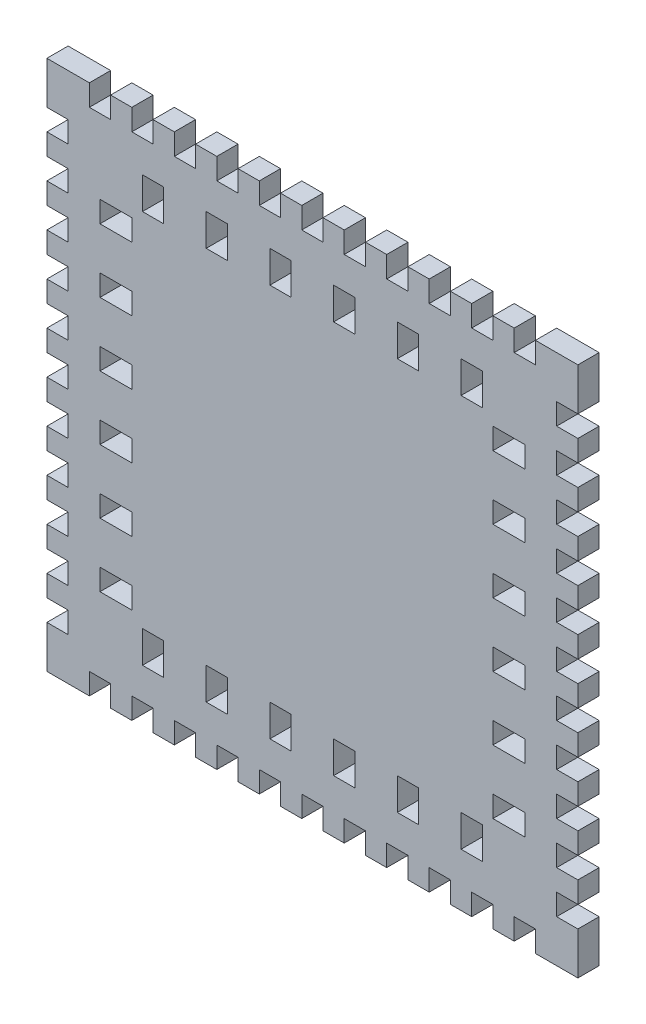
from build123d import *

# Parameters (mm, degrees)
SKETCH1_W           = 3
SKETCH1_H           = 4.5
SKETCH1_W_2         = 4.5
SKETCH1_H_2         = 3
BOSS_EXTRUDE1_DEPTH = 3


with BuildPart() as part:
    # Sketch1 → Boss-Extrude1 (new body)
    with BuildSketch(Plane.XY):
        Polygon((63, 222), (63, 225), (66, 225), (66, 222), (69, 222), (69, 225), (72, 225), (72, 222), (78, 222), (78, 228), (75, 228), (75, 231), (78, 231), (78, 234), (75, 234), (75, 237), (78, 237), (78, 240), (75, 240), (75, 243), (78, 243), (78, 246), (75, 246), (75, 249), (78, 249), (78, 252), (75, 252), (75, 255), (78, 255), (78, 258), (75, 258), (75, 261), (78, 261), (78, 264), (75, 264), (75, 267), (78, 267), (78, 270), (75, 270), (75, 273), (78, 273), (78, 276), (75, 276), (75, 279), (78, 279), (78, 282), (75, 282), (75, 285), (78, 285), (78, 288), (75, 288), (75, 291), (78, 291), (78, 297), (72, 297), (72, 294), (69, 294), (69, 297), (66, 297), (66, 294), (63, 294), (63, 297), (60, 297), (60, 294), (57, 294), (57, 297), (54, 297), (54, 294), (51, 294), (51, 297), (48, 297), (48, 294), (45, 294), (45, 297), (42, 297), (42, 294), (39, 294), (39, 297), (36, 297), (36, 294), (33, 294), (33, 297), (30, 297), (30, 294), (27, 294), (27, 297), (24, 297), (24, 294), (21, 294), (21, 297), (18, 297), (18, 294), (15, 294), (15, 297), (12, 297), (12, 294), (9, 294), (9, 297), (3, 297), (3, 291), (6, 291), (6, 288), (3, 288), (3, 285), (6, 285), (6, 282), (3, 282), (3, 279), (6, 279), (6, 276), (3, 276), (3, 273), (6, 273), (6, 270), (3, 270), (3, 267), (6, 267), (6, 264), (3, 264), (3, 261), (6, 261), (6, 258), (3, 258), (3, 255), (6, 255), (6, 252), (3, 252), (3, 249), (6, 249), (6, 246), (3, 246), (3, 243), (6, 243), (6, 240), (3, 240), (3, 237), (6, 237), (6, 234), (3, 234), (3, 231), (6, 231), (6, 228), (3, 228), (3, 222), (9, 222), (9, 225), (12, 225), (12, 222), (15, 222), (15, 225), (18, 225), (18, 222), (21, 222), (21, 225), (24, 225), (24, 222), (27, 222), (27, 225), (30, 225), (30, 222), (33, 222), (33, 225), (36, 225), (36, 222), (39, 222), (39, 225), (42, 225), (42, 222), (45, 222), (45, 225), (48, 225), (48, 222), (51, 222), (51, 225), (54, 225), (54, 222), (57, 222), (57, 225), (60, 225), (60, 222), align=None)
        with Locations((27, 287.25)):
            Rectangle(SKETCH1_W, SKETCH1_H, mode=Mode.SUBTRACT)
        with Locations((18, 287.25)):
            Rectangle(SKETCH1_W, SKETCH1_H, mode=Mode.SUBTRACT)
        with Locations((12.75, 282)):
            Rectangle(SKETCH1_W_2, SKETCH1_H_2, mode=Mode.SUBTRACT)
        with Locations((12.75, 273)):
            Rectangle(SKETCH1_W_2, SKETCH1_H_2, mode=Mode.SUBTRACT)
        with Locations((12.75, 264)):
            Rectangle(SKETCH1_W_2, SKETCH1_H_2, mode=Mode.SUBTRACT)
        with Locations((12.75, 255)):
            Rectangle(SKETCH1_W_2, SKETCH1_H_2, mode=Mode.SUBTRACT)
        with Locations((12.75, 246)):
            Rectangle(SKETCH1_W_2, SKETCH1_H_2, mode=Mode.SUBTRACT)
        with Locations((12.75, 237)):
            Rectangle(SKETCH1_W_2, SKETCH1_H_2, mode=Mode.SUBTRACT)
        with Locations((18, 231.75)):
            Rectangle(SKETCH1_W, SKETCH1_H, mode=Mode.SUBTRACT)
        with Locations((27, 231.75)):
            Rectangle(SKETCH1_W, SKETCH1_H, mode=Mode.SUBTRACT)
        with Locations((36, 231.75)):
            Rectangle(SKETCH1_W, SKETCH1_H, mode=Mode.SUBTRACT)
        with Locations((45, 231.75)):
            Rectangle(SKETCH1_W, SKETCH1_H, mode=Mode.SUBTRACT)
        with Locations((54, 231.75)):
            Rectangle(SKETCH1_W, SKETCH1_H, mode=Mode.SUBTRACT)
        with Locations((63, 231.75)):
            Rectangle(SKETCH1_W, SKETCH1_H, mode=Mode.SUBTRACT)
        with Locations((68.25, 237)):
            Rectangle(SKETCH1_W_2, SKETCH1_H_2, mode=Mode.SUBTRACT)
        with Locations((68.25, 246)):
            Rectangle(SKETCH1_W_2, SKETCH1_H_2, mode=Mode.SUBTRACT)
        with Locations((68.25, 255)):
            Rectangle(SKETCH1_W_2, SKETCH1_H_2, mode=Mode.SUBTRACT)
        with Locations((68.25, 264)):
            Rectangle(SKETCH1_W_2, SKETCH1_H_2, mode=Mode.SUBTRACT)
        with Locations((68.25, 273)):
            Rectangle(SKETCH1_W_2, SKETCH1_H_2, mode=Mode.SUBTRACT)
        with Locations((68.25, 282)):
            Rectangle(SKETCH1_W_2, SKETCH1_H_2, mode=Mode.SUBTRACT)
        with Locations((63, 287.25)):
            Rectangle(SKETCH1_W, SKETCH1_H, mode=Mode.SUBTRACT)
        with Locations((54, 287.25)):
            Rectangle(SKETCH1_W, SKETCH1_H, mode=Mode.SUBTRACT)
        with Locations((45, 287.25)):
            Rectangle(SKETCH1_W, SKETCH1_H, mode=Mode.SUBTRACT)
        with Locations((36, 287.25)):
            Rectangle(SKETCH1_W, SKETCH1_H, mode=Mode.SUBTRACT)
    extrude(amount=BOSS_EXTRUDE1_DEPTH)


solid = part.part
